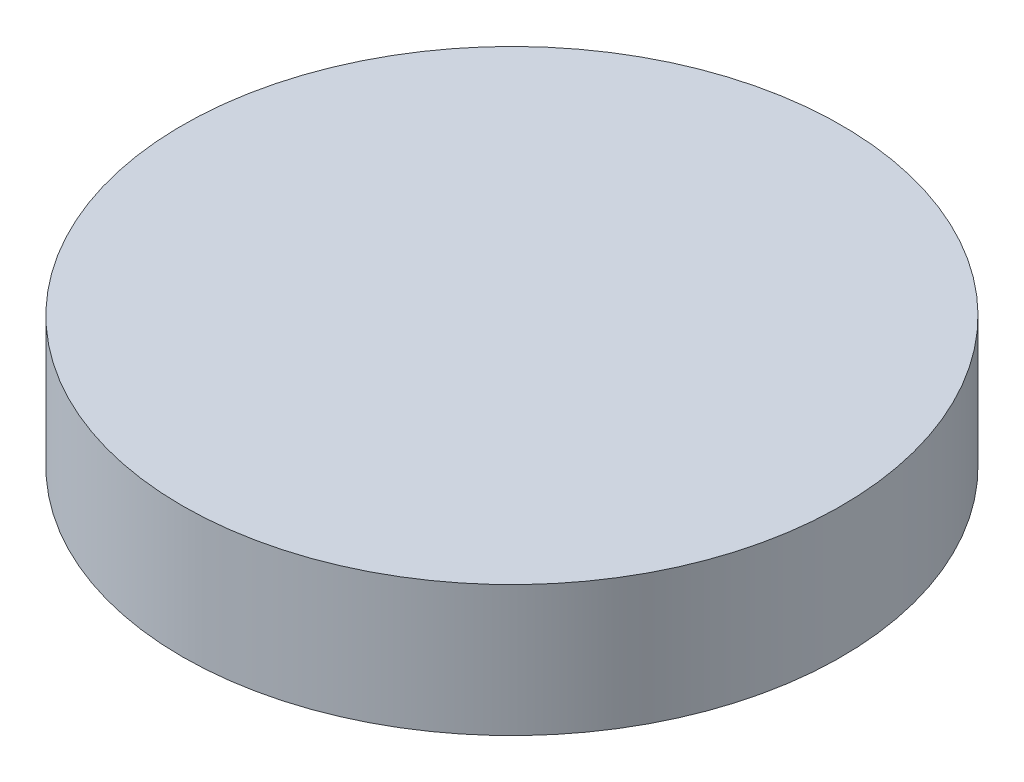
from build123d import *

# Parameters (mm, degrees)
SKETCH1_R           = 63
BOSS_EXTRUDE1_DEPTH = 25
SKETCH2_R           = 60
CUT_EXTRUDE2_DEPTH  = 20
SKETCH3_R           = 7.5
BOSS_EXTRUDE2_DEPTH = 20
EXTRUDE_THIN3_DEPTH = 20


with BuildPart() as part:
    # Sketch1 → Boss-Extrude1 (new body)
    with BuildSketch(Plane(origin=(0, 0, 0), x_dir=(1, 0, 0), z_dir=(0, 1, 0))):
        with Locations(Location((0, 0, 0), (0, 0, 270))):
            Circle(SKETCH1_R)
    extrude(amount=BOSS_EXTRUDE1_DEPTH)

    # Sketch2 → Cut-Extrude2 (cut)
    with BuildSketch(Plane.XZ):
        with Locations(Location((0, 0, 0), (0, 0, 270))):
            Circle(SKETCH2_R)
    extrude(amount=-CUT_EXTRUDE2_DEPTH, mode=Mode.SUBTRACT)

    # Sketch3 → Boss-Extrude2 (add)
    with BuildSketch(Plane.XZ.offset(-20)):
        with Locations(Location((0, 0, 0), (0, 0, 270))):
            Circle(SKETCH3_R)
    extrude(amount=BOSS_EXTRUDE2_DEPTH)

    # Sketch4 → Extrude-Thin3 (add, through all)
    with BuildSketch(Plane.XZ.offset(-20)):
        Polygon((-23.273288682, 57.13837857), (23.273288682, -57.13837857), (21.421043823, -57.892824713), (-25.125533541, 56.383932427), align=None)
        Polygon((23.946234705, 56.8596352), (-23.946234705, -56.8596352), (-25.789443589, -56.083374284), (22.103025822, 57.635896117), align=None)
        Polygon((57.13837857, 23.273288682), (-57.13837857, -23.273288682), (-57.892824713, -21.421043823), (56.383932427, 25.125533541), align=None)
        Polygon((56.8596352, -23.946234705), (-56.8596352, 23.946234705), (-56.083374284, 25.789443589), (57.635896117, -22.103025822), align=None)
    extrude(amount=EXTRUDE_THIN3_DEPTH)


solid = part.part
